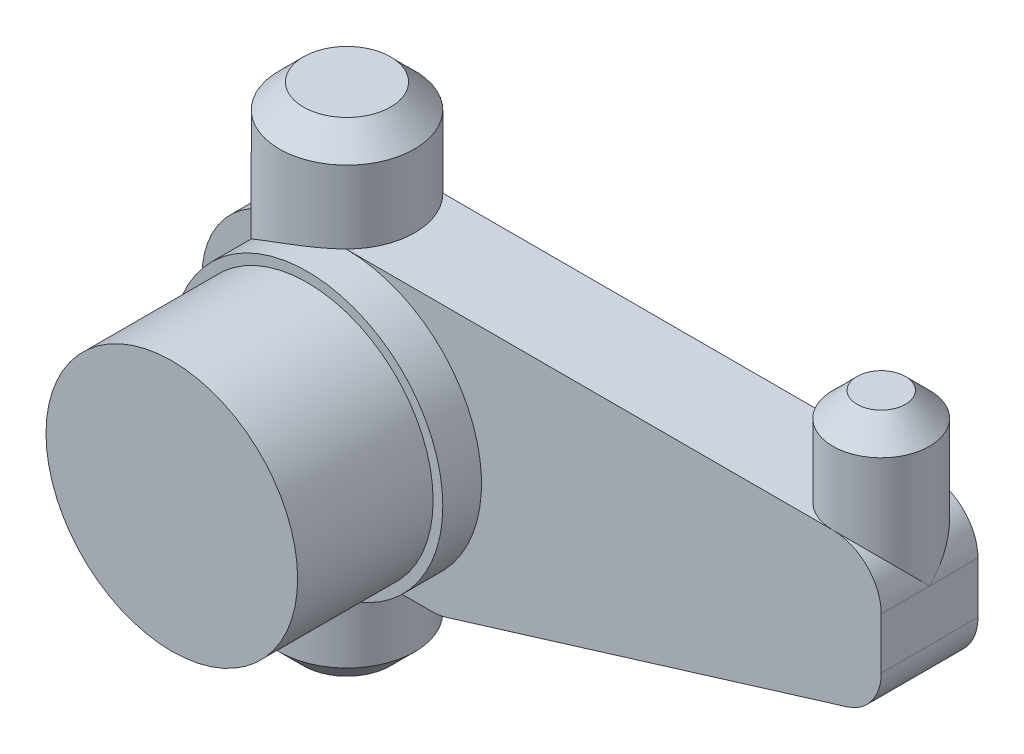
from build123d import *

# Parameters (mm, degrees)
BOSS_EXTRUDE1_DEPTH      = 10
FILLET1_R                = 10
FILLET2_R                = 5
BOSS_EXTRUDE2_DEPTH      = 10
BOSS_EXTRUDE2_DEPTH_BACK = 40
SKETCH2_R                = 7
BOSS_EXTRUDE3_START      = -5
SKETCH3_R                = 5
BOSS_EXTRUDE3_DEPTH      = 15
CHAMFER1_SIZE            = 2.5
BOSS_EXTRUDE4_DEPTH      = 18
BOSS_EXTRUDE4_DEPTH_BACK = 10
SKETCH4_R                = 13
SKETCH5_R                = 14
BOSS_EXTRUDE5_DEPTH      = 4


with BuildPart() as part:
    # Sketch1 → Boss-Extrude1 (new body)
    with BuildSketch(Plane.XY):
        Polygon((-58.818184361, 21.563458262), (11.382033939, 21.563458262), (11.382033939, 7.563458262), (-34.282866194, -6.436541738), (-58.818184361, -6.436541738), align=None)
    extrude(amount=BOSS_EXTRUDE1_DEPTH)

    # Fillet1
    fillet1_edges = [part.edges().sort_by_distance(p)[0] for p in [
        (-58.818184361, 21.563458262, 5),
        (-58.818184361, -6.436541738, 5),
    ]]
    fillet(fillet1_edges, radius=FILLET1_R)

    # Fillet2
    fillet2_edges = [part.edges().sort_by_distance(p)[0] for p in [
        (11.382033939, 21.563458262, 5),
        (11.382033939, 7.563458262, 5),
        (-34.282866194, -6.436541738, 5),
    ]]
    fillet(fillet2_edges, radius=FILLET2_R)

    # Sketch2 → Boss-Extrude2 (add, two sides: drawn at the far end of the back side and taken through both)
    with BuildSketch(Plane(origin=(0, 21.563458262, 0), x_dir=(1, 0, 0), z_dir=(0, 1, 0)).offset(-BOSS_EXTRUDE2_DEPTH_BACK)):
        with Locations(Location((-48.818184361, -5, 0), (0, 0, 270))):
            Circle(SKETCH2_R)
    extrude(amount=BOSS_EXTRUDE2_DEPTH + BOSS_EXTRUDE2_DEPTH_BACK)

    # Sketch3 → Boss-Extrude3 (add)
    with BuildSketch(Plane(origin=(0, 21.563458262, 0), x_dir=(1, 0, 0), z_dir=(0, 1, 0)).offset(BOSS_EXTRUDE3_START)):
        with Locations(Location((6.382033939, -5, 0), (0, 0, 270))):
            Circle(SKETCH3_R)
    extrude(amount=BOSS_EXTRUDE3_DEPTH)

    # Chamfer1
    chamfer1_edges = [part.edges().sort_by_distance(p)[0] for p in [
        (-48.818184361, -18.436541738, -2),
        (-48.818184361, 31.563458262, -2),
        (6.382033939, 31.563458262, 0),
    ]]
    chamfer(chamfer1_edges, length=CHAMFER1_SIZE)

    # Sketch4 → Boss-Extrude4 (add, two sides: drawn at the far end of the back side and taken through both)
    with BuildSketch(Plane.XY.offset(10).offset(-BOSS_EXTRUDE4_DEPTH_BACK)):
        with Locations((-43.919204876, 7.563458262)):
            Circle(SKETCH4_R)
    extrude(amount=BOSS_EXTRUDE4_DEPTH + BOSS_EXTRUDE4_DEPTH_BACK)

    # Sketch5 → Boss-Extrude5 (add)
    with BuildSketch(Plane.XY.offset(10)):
        with Locations(Location((-43.919204876, 7.563458262, 0), (0, 0, 134.415308597))):
            Circle(SKETCH5_R)
    extrude(amount=BOSS_EXTRUDE5_DEPTH)


solid = part.part
